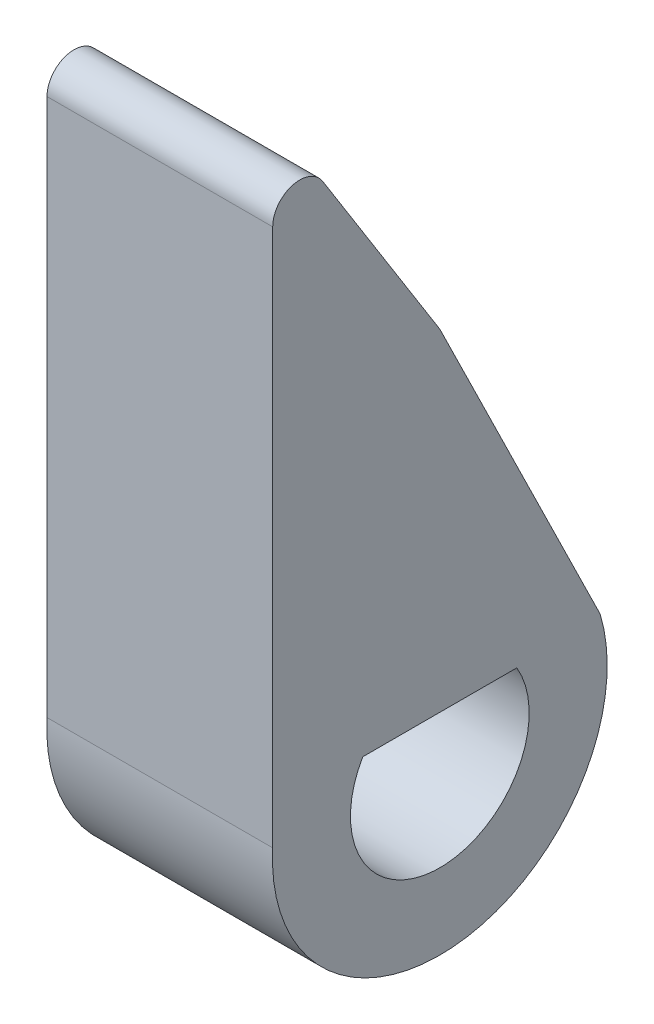
from build123d import *

# Parameters (mm, degrees)
BOSS_EXTRUDE2_DEPTH = 2.5
SKETCH4_R           = 0.99
CUT_EXTRUDE2_DEPTH  = 64.981998238
SKETCH7_W           = 2.01987101
SKETCH7_H           = 0.78494751
BOSS_EXTRUDE5_DEPTH = 2.5
FILLET1_R           = 0.2
BOSS_EXTRUDE6_DEPTH = 2.5
CUT_EXTRUDE5_DEPTH  = 66.492743437
FILLET14_R          = 0.3


with BuildPart() as part:
    # Sketch3 → Boss-Extrude2 (new body)
    with BuildSketch(Plane(origin=(0, 0, 0), x_dir=(0, 0, -1), z_dir=(1, 0, 0))):
        with BuildLine():
            Line((-54.67077374, 30.968825597), (-55.447230875, 28.071048118))
            ThreePointArc((-55.447230875, 28.071048118), (-53.67077374, 25.686416202), (-51.894316605, 28.071048118))
            Line((-51.894316605, 28.071048118), (-52.67077374, 30.968825597))
            ThreePointArc((-52.67077374, 30.968825597), (-53.67077374, 31.692969852), (-54.67077374, 30.968825597))
        make_face()
    extrude(amount=BOSS_EXTRUDE2_DEPTH)

    # Sketch4 → Cut-Extrude2 (cut, through all)
    with BuildSketch(Plane(origin=(2.5, 0, 0), x_dir=(0, 0, -1), z_dir=(1, 0, 0))):
        with Locations((-53.67077374, 27.514195996)):
            Circle(SKETCH4_R)
    extrude(amount=-CUT_EXTRUDE2_DEPTH, mode=Mode.SUBTRACT)

    # Sketch7 → Boss-Extrude5 (add)
    with BuildSketch(Plane(origin=(2.5, 0, 0), x_dir=(0, 0, -1), z_dir=(1, 0, 0))):
        with Locations((-53.657499813, 28.408869671)):
            Rectangle(SKETCH7_W, SKETCH7_H)
    extrude(amount=-BOSS_EXTRUDE5_DEPTH)

    # Fillet1
    fillet1_edges = [part.edges().sort_by_distance(p)[0] for p in [
        (0, 26.524195996, 53.67077374),
        (0, 28.016395916, 53.67077374),
    ]]
    fillet(fillet1_edges, radius=FILLET1_R)

    # Sketch8 → Boss-Extrude6 (add)
    with BuildSketch(Plane(origin=(2.5, 0, 0), x_dir=(0, 0, -1), z_dir=(1, 0, 0))):
        Polygon((-55.522016872, 27.641704373), (-55.522016872, 34.641704373), (-53.67077374, 31.692969852), align=None)
    extrude(amount=-BOSS_EXTRUDE6_DEPTH)

    # Sketch12 → Cut-Extrude5 (cut, through all)
    with BuildSketch(Plane(origin=(2.5, 0, 0), x_dir=(0, 0, -1), z_dir=(1, 0, 0))):
        Polygon((-53.67077374, 31.692969852), (-51.894316605, 28.071048118), (-51.781619292, 31.692969852), align=None)
    extrude(amount=-CUT_EXTRUDE5_DEPTH, mode=Mode.SUBTRACT)

    # Fillet14
    fillet14_edges = [part.edges().sort_by_distance(p)[0] for p in [
        (1.25, 34.641704373, 55.522016872),
    ]]
    fillet(fillet14_edges, radius=FILLET14_R)


solid = part.part
